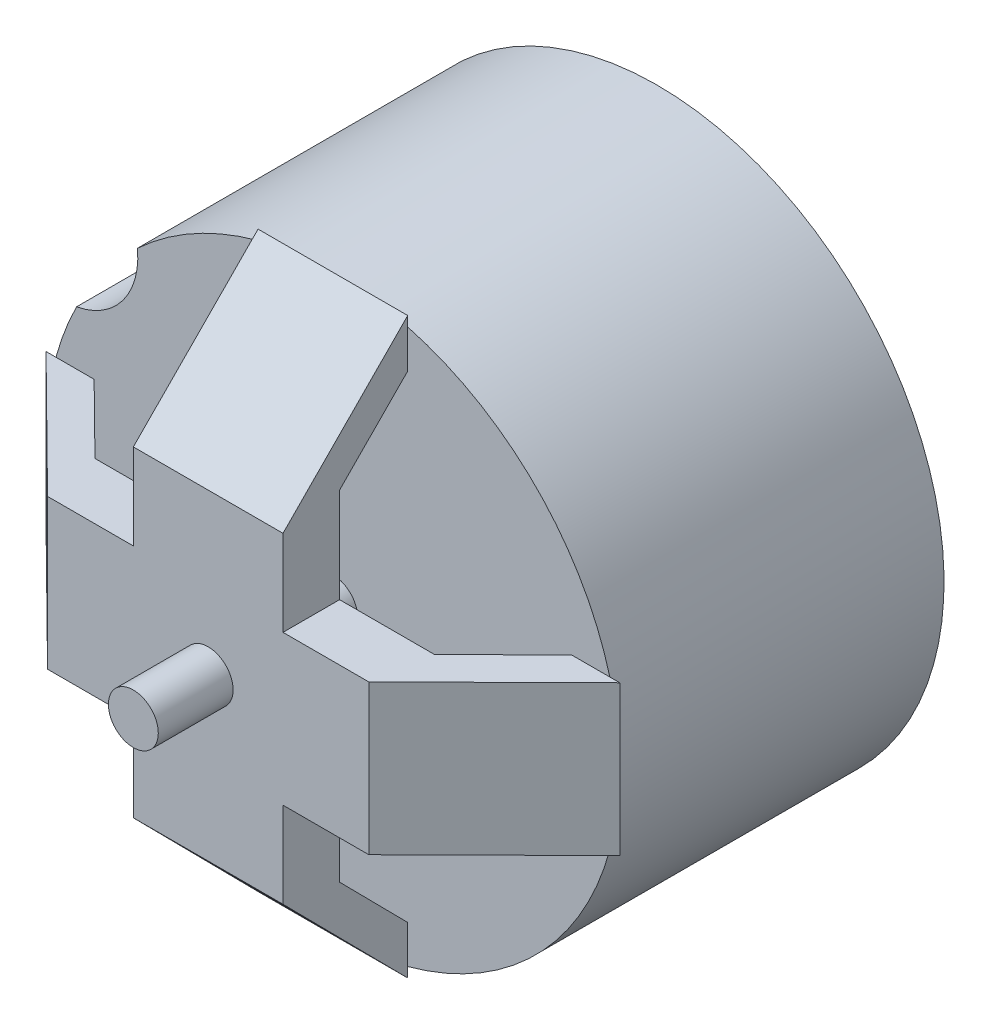
from build123d import *

# Parameters (mm, degrees)
Y_KSEKLIK_EKSTR_ZYON1_DEPTH      = 13
IZIM1_2_R                        = 1.5
Y_KSEKLIK_EKSTR_ZYON2_DEPTH      = 2
IZIM1_4_R                        = 2.5
IZIM1_4_R_2                      = 1.5
Y_KSEKLIK_EKSTR_ZYON3_DEPTH      = 0.8
Y_KSEKLIK_EKSTR_ZYON4_DEPTH      = 3
DAIRESEL_KAPLAMA1_COUNT          = 4
Y_KSEKLIK_EKSTR_ZYON5_DEPTH      = 3
Y_KSEKLIK_EKSTR_ZYON5_DEPTH_BACK = 8.2
IZIM7_R                          = 1
KES_EKSTR_ZYON2_DEPTH            = 15
IZIM1_7_R                        = 1.5
KES_EKSTR_ZYON3_DEPTH            = 3
KES_EKSTR_ZYON4_START            = 0.2
IZIM1_8_R                        = 4
IZIM1_8_R_2                      = 2.5
KES_EKSTR_ZYON4_DEPTH            = 0.2


with BuildPart() as part:
    # Çizim1 → Yükseklik-Ekstrüzyon1 (new body)
    with BuildSketch(Plane.XY):
        with BuildLine():
            ThreePointArc((-10.274965018, 5.164793693), (9.2, -6.9), (-7.83519215, 8.417824183))
            ThreePointArc((-7.83519215, 8.417824183), (-8.419858501, 6.314893876), (-10.274965018, 5.164793693))
        make_face()
    y_kseklik_ekstr_zyon1 = extrude(amount=Y_KSEKLIK_EKSTR_ZYON1_DEPTH)

    # Çizim1<2> → Yükseklik-Ekstrüzyon2 (add)
    with BuildSketch(Plane.XY):
        Circle(IZIM1_2_R)
    extrude(amount=-Y_KSEKLIK_EKSTR_ZYON2_DEPTH)

    # Çizim1<4> → Yükseklik-Ekstrüzyon3 (add)
    with BuildSketch(Plane.XY):
        Circle(IZIM1_4_R)
        Circle(IZIM1_4_R_2, mode=Mode.SUBTRACT)
    extrude(amount=-Y_KSEKLIK_EKSTR_ZYON3_DEPTH)

    # Çizim5 → Yükseklik-Ekstrüzyon4 (add, symmetric)
    with BuildSketch(Plane(origin=(0, 0, 0), x_dir=(0, 0, -1), z_dir=(1, 0, 0))):
        Polygon((-13, 11.5), (-18, 6.43916486), (-18, 0), (-15.732419213, 0), (-15.732419213, 6.806119772), (-13, 9.571784407), align=None)
    y_kseklik_ekstr_zyon4 = extrude(amount=Y_KSEKLIK_EKSTR_ZYON4_DEPTH, both=True)

    # Dairesel Kaplama1: Yükseklik-Ekstrüzyon1, Yükseklik-Ekstrüzyon4 ×4 about axis
    dairesel_kaplama1_axis = Axis((0, 0, 13), (0, 0, 1))
    add([y_kseklik_ekstr_zyon1.rotate(dairesel_kaplama1_axis, i * 360 / DAIRESEL_KAPLAMA1_COUNT) for i in range(1, DAIRESEL_KAPLAMA1_COUNT)])
    add([y_kseklik_ekstr_zyon4.rotate(dairesel_kaplama1_axis, i * 360 / DAIRESEL_KAPLAMA1_COUNT) for i in range(1, DAIRESEL_KAPLAMA1_COUNT)])

    # Çizim7 → Yükseklik-Ekstrüzyon5 (add, two sides: drawn at the far end of the back side and taken through both)
    with BuildSketch(Plane.XY.offset(18).offset(-Y_KSEKLIK_EKSTR_ZYON5_DEPTH_BACK)):
        Circle(IZIM7_R)
    extrude(amount=Y_KSEKLIK_EKSTR_ZYON5_DEPTH + Y_KSEKLIK_EKSTR_ZYON5_DEPTH_BACK)

    # Çizim1<6> → Kes-Ekstrüzyon2 (cut)
    with BuildSketch(Plane.XY):
        with BuildLine():
            ThreePointArc((-7.819858501, 8.114893876), (-7.823694366, 8.266552944), (-7.83519215, 8.417824183))
            ThreePointArc((-7.83519215, 8.417824183), (-9.2, 6.9), (-10.274965018, 5.164793693))
            ThreePointArc((-10.274965018, 5.164793693), (-8.513922634, 6.19586814), (-7.819858501, 8.114893876))
        make_face()
    extrude(amount=KES_EKSTR_ZYON2_DEPTH, mode=Mode.SUBTRACT)

    # Çizim1<7> → Kes-Ekstrüzyon3 (cut)
    with BuildSketch(Plane.XY):
        with Locations((0, 6)):
            Circle(IZIM1_7_R)
        with Locations((0, -6)):
            Circle(IZIM1_7_R)
        with Locations((-8, 0)):
            Circle(IZIM1_7_R)
        with Locations((8, 0)):
            Circle(IZIM1_7_R)
    extrude(amount=KES_EKSTR_ZYON3_DEPTH, mode=Mode.SUBTRACT)

    # Çizim1<8> → Kes-Ekstrüzyon4 (cut)
    with BuildSketch(Plane.XY.offset(KES_EKSTR_ZYON4_START)):
        Circle(IZIM1_8_R)
        Circle(IZIM1_8_R_2, mode=Mode.SUBTRACT)
    extrude(amount=-KES_EKSTR_ZYON4_DEPTH, mode=Mode.SUBTRACT)


solid = part.part
